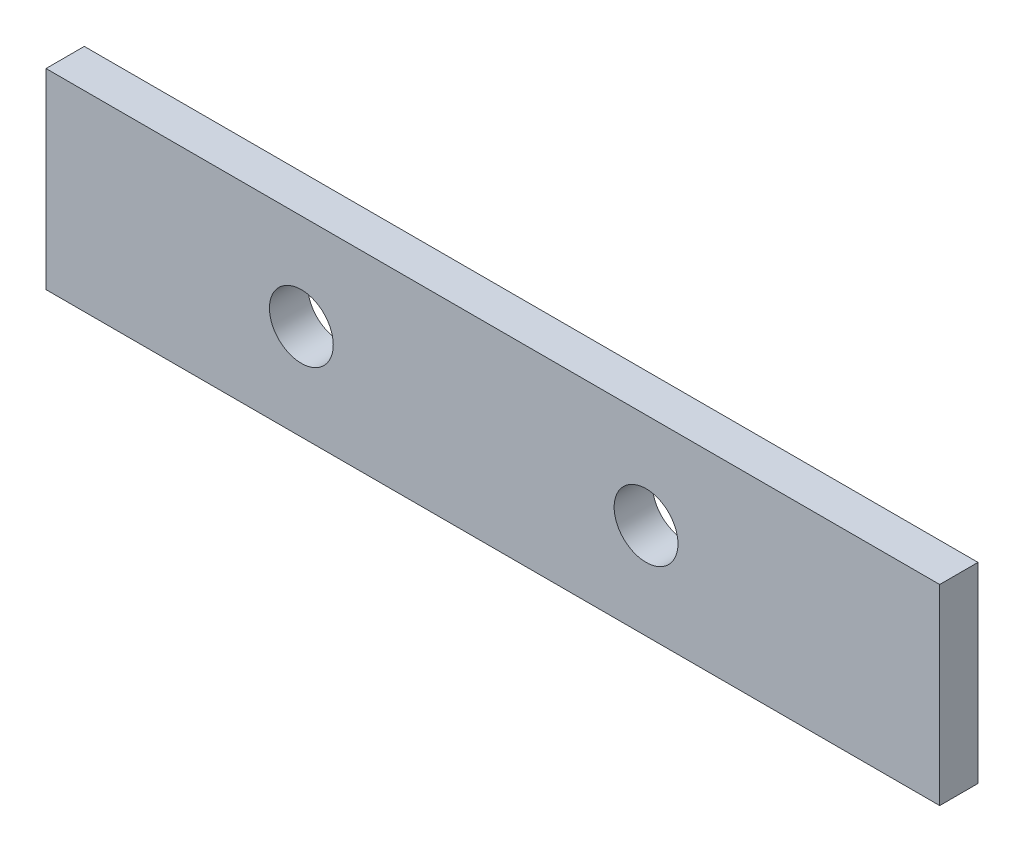
from build123d import *

# Parameters (mm, degrees)
SKETCH1_W           = 700
SKETCH1_H           = 150
SKETCH1_R           = 25
BOSS_EXTRUDE1_DEPTH = 30


with BuildPart() as part:
    # Sketch1 → Boss-Extrude1 (new body)
    with BuildSketch(Plane.XY):
        Rectangle(SKETCH1_W, SKETCH1_H)
        with Locations((-150, 0)):
            Circle(SKETCH1_R, mode=Mode.SUBTRACT)
        with Locations((120, 0)):
            Circle(SKETCH1_R, mode=Mode.SUBTRACT)
    extrude(amount=-BOSS_EXTRUDE1_DEPTH)


solid = part.part
